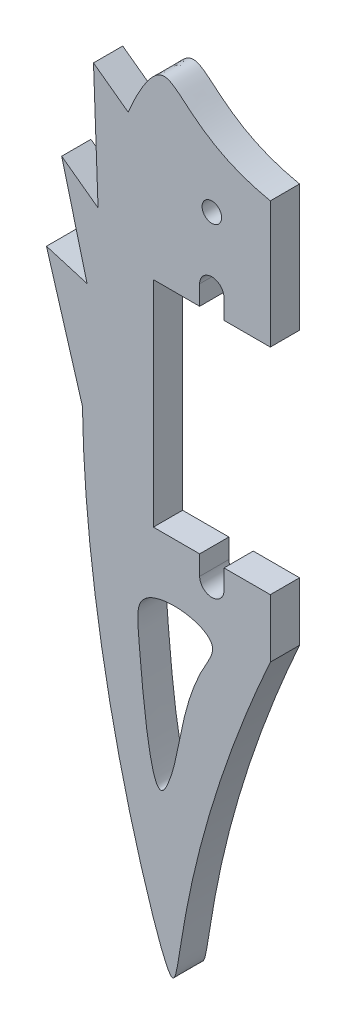
from build123d import *

# Parameters (mm, degrees)
BOSS_EXTRUDE1_DEPTH = 3
SKETCH2_R           = 1
CUT_EXTRUDE1_DEPTH  = 3
BOSS_EXTRUDE2_DEPTH = 3


with BuildPart() as part:
    # Sketch1 → Boss-Extrude1 (new body)
    with BuildSketch(Plane.XY):
        with BuildLine():
            Line((6, -11), (6, -17))
            add(Edge.make_bspline(
                [(6, 24), (-2.035422541, 25.648260551), (-4.364738489, 33.472609795), (-18.087854919, 6.045354672), (-10.759793685, -32.97886738), (-2.444038674, -55.634773346), (-4.102162361, -39.466836046), (6, -17)],
                knots=[0, 0, 0, 0, 0.114542044, 0.190676288, 0.697935085, 0.785208191, 1, 1, 1, 1], degree=3))
            Line((6, 24), (6, 11))
            Line((6, 11), (-6, 11))
            Line((-6, 11), (-6, -11))
            Line((-6, -11), (6, -11))
        make_face()
    extrude(amount=BOSS_EXTRUDE1_DEPTH)

    # Sketch2 → Cut-Extrude1 (cut)
    with BuildSketch(Plane.XY.offset(3)):
        with Locations((0, 20)):
            Circle(SKETCH2_R)
        with BuildLine():
            add(Edge.make_bspline(
                [(-4.513595519, -33.081307991), (-3.201652168, -30.129435451), (-3.369548093, -24.659658085), (1.613832467, -17.027054038), (-7.932038094, -15.936643899), (-7.198314235, -25.753279749), (-6.104582243, -36.122768424), (-4.657034373, -33.404045413), (-4.513595519, -33.081307991)],
                knots=[0, 0, 0, 0, 0.359584139, 0.420269685, 0.586123704, 0.646169911, 0.960685546, 1, 1, 1, 1], degree=3))
        make_face()
        with BuildLine():
            Line((1.25, 13), (1.25, 11))
            Line((1.25, 11), (-1.25, 11))
            Line((-1.25, 11), (-1.25, 13))
            ThreePointArc((-1.25, 13), (0, 14.25), (1.25, 13))
        make_face()
        with BuildLine():
            Line((-1.25, -13), (-1.25, -11))
            Line((-1.25, -11), (1.25, -11))
            Line((1.25, -11), (1.25, -13))
            ThreePointArc((1.25, -13), (0, -14.25), (-1.25, -13))
        make_face()
    extrude(amount=-CUT_EXTRUDE1_DEPTH, mode=Mode.SUBTRACT)

    # Sketch4 → Boss-Extrude2 (add)
    with BuildSketch(Plane.XY.offset(3)):
        with BuildLine():
            add(Edge.make_bspline(
                [(-11.676607019, 14.534270577), (-12.174316309, 12.157156632), (-12.545458588, 9.719152258), (-12.805382384, 7.244103444)],
                knots=[0.253882029, 0.253882029, 0.253882029, 0.253882029, 0.306471969, 0.306471969, 0.306471969, 0.306471969], degree=3))
            Line((-11.676607019, 14.534270577), (-15.409911693, 17.263943237))
            Line((-15.409911693, 17.263943237), (-12.805382384, 7.244103444))
        make_face()
        with BuildLine():
            add(Edge.make_bspline(
                [(-8.591487817, 24.590895393), (-8.838650036, 24.011350371), (-10.117192838, 20.799261888), (-11.078430158, 17.391228621), (-11.676607019, 14.534270577)],
                knots=[0.176089695, 0.176089695, 0.176089695, 0.176089695, 0.190676288, 0.253882029, 0.253882029, 0.253882029, 0.253882029], degree=3))
            Line((-8.591487817, 24.590895393), (-12.14478008, 27.18894875))
            Line((-12.14478008, 27.18894875), (-11.676607019, 14.534270577))
        make_face()
        with BuildLine():
            add(Edge.make_bspline(
                [(-12.805382384, 7.244103444), (-13.189807592, 3.583526115), (-13.330951571, -0.15808286), (-13.278469454, -3.90357759)],
                knots=[0.306471969, 0.306471969, 0.306471969, 0.306471969, 0.384252067, 0.384252067, 0.384252067, 0.384252067], degree=3))
            Line((-12.805382384, 7.244103444), (-16.972150842, 8.481257336))
            Line((-16.972150842, 8.481257336), (-13.278469454, -3.90357759))
        make_face()
    extrude(amount=-BOSS_EXTRUDE2_DEPTH)


solid = part.part
